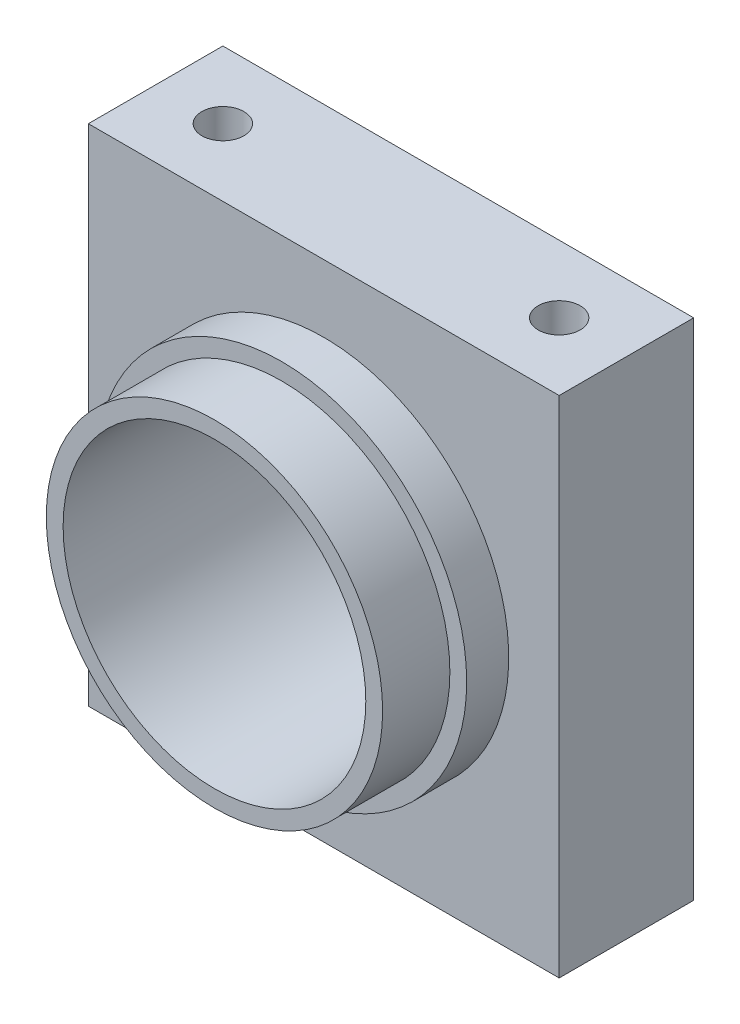
from build123d import *

# Parameters (mm, degrees)
SKETCH_1_W             = 28
SKETCH_1_H             = 30
SKETCH_1_R             = 9
EXTRUDE_1_DEPTH        = 8
SKETCH_2_R             = 11
SKETCH_2_R_2           = 9
EXTRUDE_2_DEPTH        = 2.5
SKETCH_3_R             = 10
SKETCH_3_R_2           = 9
EXTRUDE_3_DEPTH        = 4
HOLE_WIZARD_M3_1_D     = 2.5
HOLE_WIZARD_M3_1_DEPTH = 10
HOLE_WIZARD_M3_1_TIP   = 0.751075774
HOLE_WIZARD_M3_2_D     = 2.5
HOLE_WIZARD_M3_2_DEPTH = 10
HOLE_WIZARD_M3_2_TIP   = 0.751075774


with BuildPart() as part:
    # 草图1 → 凸台-拉伸1 (new body)
    with BuildSketch(Plane.XY):
        Rectangle(SKETCH_1_W, SKETCH_1_H)
        Circle(SKETCH_1_R, mode=Mode.SUBTRACT)
    extrude(amount=EXTRUDE_1_DEPTH)

    # 草图2 → 凸台-拉伸2 (add)
    with BuildSketch(Plane.XY.offset(8)):
        with Locations(Location((0, 0, 0), (0, 0, 180))):
            Circle(SKETCH_2_R)
        Circle(SKETCH_2_R_2, mode=Mode.SUBTRACT)
    extrude(amount=EXTRUDE_2_DEPTH)

    # 草图3 → 凸台-拉伸3 (add)
    with BuildSketch(Plane.XY.offset(10.5)):
        Circle(SKETCH_3_R)
        Circle(SKETCH_3_R_2, mode=Mode.SUBTRACT)
    extrude(amount=EXTRUDE_3_DEPTH)

    # M3 螺纹孔1
    with Locations(Plane(origin=(0, 15, 0), x_dir=(1, 0, 0), z_dir=(0, 1, 0))):
        with Locations((-10, -4), (10, -4)):
            Hole(HOLE_WIZARD_M3_1_D / 2, depth=HOLE_WIZARD_M3_1_DEPTH)
            with Locations((0, 0, -(HOLE_WIZARD_M3_1_DEPTH + HOLE_WIZARD_M3_1_TIP / 2))):  # 118° drill point
                Cone(0, HOLE_WIZARD_M3_1_D / 2, HOLE_WIZARD_M3_1_TIP, mode=Mode.SUBTRACT)

    # M3 螺纹孔2
    with Locations(Plane(origin=(0, -15, 0), x_dir=(-1, 0, 0), z_dir=(0, -1, 0))):
        with Locations((-10, -4), (10, -4)):
            Hole(HOLE_WIZARD_M3_2_D / 2, depth=HOLE_WIZARD_M3_2_DEPTH)
            with Locations((0, 0, -(HOLE_WIZARD_M3_2_DEPTH + HOLE_WIZARD_M3_2_TIP / 2))):  # 118° drill point
                Cone(0, HOLE_WIZARD_M3_2_D / 2, HOLE_WIZARD_M3_2_TIP, mode=Mode.SUBTRACT)


solid = part.part
